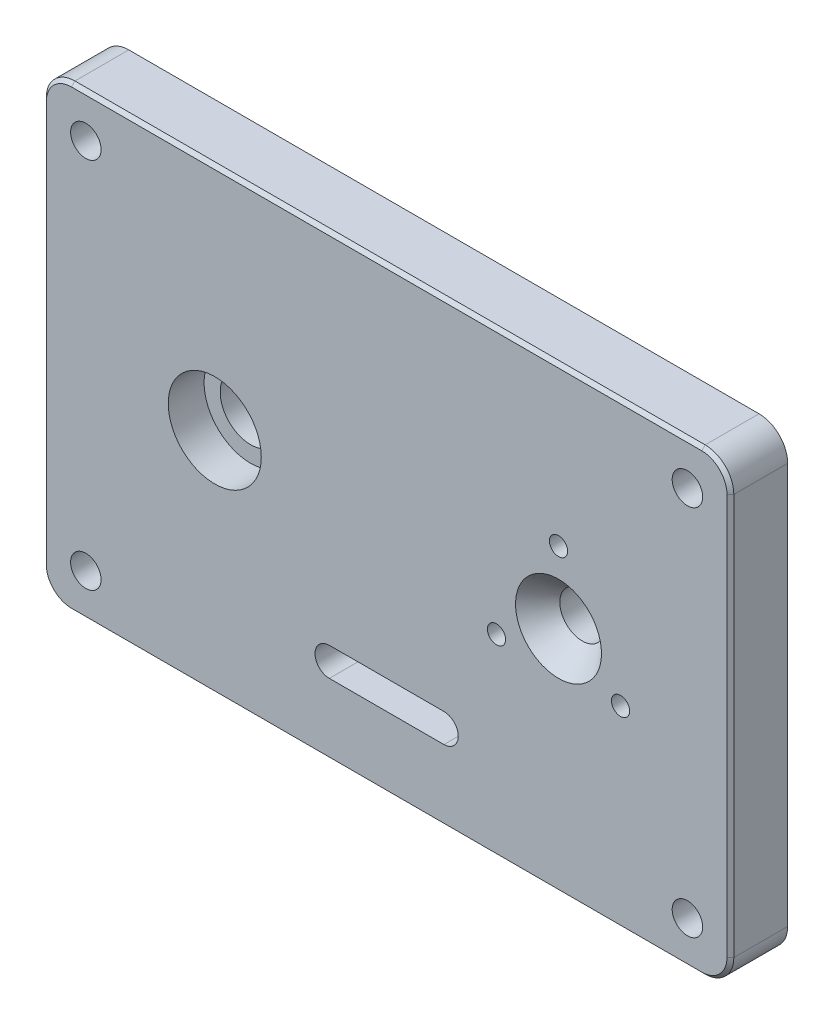
from build123d import *

# Parameters (mm, degrees)
EXTRUDE_1_DEPTH               = 12.7
SKETCH_2_R                    = 3.3782
CUT_EXTRUDE_1_DEPTH           = 184.601770144
SKETCH_5_R                    = 10.3125
CUT_EXTRUDE_4_DEPTH           = 7.95
SKETCH_6_R                    = 6.7435
CUT_EXTRUDE_5_DEPTH           = 184.601770144
SKETCH_7_R                    = 9.525
CUT_EXTRUDE_6_DEPTH           = 5.245104753
CUT_EXTRUDE_6_DRAFT           = -41
SKETCH_8_R                    = 4.9655
CUT_EXTRUDE_7_DEPTH           = 184.601770144
SKETCH_9_R                    = 2.0193
CUT_EXTRUDE_8_DEPTH           = 9.525
SKETCH_10_R                   = 2.0193
CUT_EXTRUDE_9_DEPTH           = 1.210313545
CUT_EXTRUDE_9_DRAFT           = -59
CUT_EXTRUDE_9_PROFILE_2_DEPTH = 1.210313545
CUT_EXTRUDE_9_PROFILE_2_DRAFT = -59
CUT_EXTRUDE_9_PROFILE_3_DEPTH = 1.210313545
CUT_EXTRUDE_9_PROFILE_3_DRAFT = -59
CUT_EXTRUDE_10_DEPTH          = 184.601770144
CHAMFER_1_SIZE                = 0.762


with BuildPart() as part:
    # 草图1 → 凸台-拉伸1 (new body)
    with BuildSketch(Plane.XY):
        with BuildLine():
            Line((6.35, 0), (146.05, 0))
            ThreePointArc((146.05, 0), (150.540128061, 1.859871939), (152.4, 6.35))
            Line((152.4, 6.35), (152.4, 95.25))
            ThreePointArc((152.4, 95.25), (150.540128061, 99.740128061), (146.05, 101.6))
            Line((146.05, 101.6), (6.35, 101.6))
            ThreePointArc((6.35, 101.6), (1.859871939, 99.740128061), (0, 95.25))
            Line((0, 95.25), (0, 6.35))
            ThreePointArc((0, 6.35), (1.859871939, 1.859871939), (6.35, 0))
        make_face()
    extrude(amount=EXTRUDE_1_DEPTH)

    # 草图2 → 切除-拉伸1 (cut, through all)
    with BuildSketch(Plane.XY.offset(12.7)):
        with Locations((9.525, 9.525)):
            Circle(SKETCH_2_R)
        with Locations((142.875, 9.525)):
            Circle(SKETCH_2_R)
        with Locations((9.525, 92.075)):
            Circle(SKETCH_2_R)
        with Locations((142.875, 92.075)):
            Circle(SKETCH_2_R)
    extrude(amount=-CUT_EXTRUDE_1_DEPTH, mode=Mode.SUBTRACT)

    # 草图5 → 切除-拉伸4 (cut)
    with BuildSketch(Plane.XY.offset(12.7)):
        with Locations((38.1, 50.8)):
            Circle(SKETCH_5_R)
    extrude(amount=-CUT_EXTRUDE_4_DEPTH, mode=Mode.SUBTRACT)

    # 草图6 → 切除-拉伸5 (cut, through all)
    with BuildSketch(Plane.XY.offset(12.7)):
        with Locations((38.1, 50.8)):
            Circle(SKETCH_6_R)
    extrude(amount=-CUT_EXTRUDE_5_DEPTH, mode=Mode.SUBTRACT)


with BuildPart() as cut_extrude_6_tool:
    # 草图7 → 切除-拉伸6 (with draft: the straight prism first)
    with BuildSketch(Plane.XY.offset(12.7)):
        with Locations((114.3, 50.8)):
            Circle(SKETCH_7_R)
    extrude(amount=-CUT_EXTRUDE_6_DEPTH)
    # 切除-拉伸6: the draft: its side faces are tilted about the plane it starts from
    cut_extrude_6_sides = [cut_extrude_6_tool.faces().sort_by_distance(p)[0] for p in [
        (104.775, 50.8, 10.077447624),
    ]]
    draft(cut_extrude_6_sides, Plane.XY.offset(12.7), CUT_EXTRUDE_6_DRAFT)


with BuildPart() as part_1:
    add(part.part)

    # 切除-拉伸6: cut by cut_extrude_6_tool
    add(cut_extrude_6_tool.part, mode=Mode.SUBTRACT)

    # 草图8 → 切除-拉伸7 (cut, through all)
    with BuildSketch(Plane.XY.offset(12.7)):
        with Locations((114.3, 50.8)):
            Circle(SKETCH_8_R)
    extrude(amount=-CUT_EXTRUDE_7_DEPTH, mode=Mode.SUBTRACT)

    # 草图9 → 切除-拉伸8 (cut)
    with BuildSketch(Plane.XY.offset(12.7)):
        with Locations((114.3, 66.675)):
            Circle(SKETCH_9_R)
        with Locations((100.551847, 42.8625)):
            Circle(SKETCH_9_R)
        with Locations((128.048153, 42.8625)):
            Circle(SKETCH_9_R)
    extrude(amount=-CUT_EXTRUDE_8_DEPTH, mode=Mode.SUBTRACT)


with BuildPart() as cut_extrude_9_tool:
    # 草图10 → 切除-拉伸9 (with draft: the straight prism first)
    with BuildSketch(Plane.XY.offset(3.175)):
        with Locations((114.3, 66.675)):
            Circle(SKETCH_10_R)
    extrude(amount=-CUT_EXTRUDE_9_DEPTH)
    # 切除-拉伸9: the draft: its side faces are tilted about the plane it starts from
    cut_extrude_9_sides = [cut_extrude_9_tool.faces().sort_by_distance(p)[0] for p in [
        (112.2807, 66.675, 2.569843228),
    ]]
    draft(cut_extrude_9_sides, Plane.XY.offset(3.175), CUT_EXTRUDE_9_DRAFT)


with BuildPart() as part_2:
    add(part_1.part)

    # 切除-拉伸9: cut by cut_extrude_9_tool
    add(cut_extrude_9_tool.part, mode=Mode.SUBTRACT)


with BuildPart() as cut_extrude_9_profile_2_tool:
    # 草图10 → 切除-拉伸9 profile 2 (with draft: the straight prism first)
    with BuildSketch(Plane.XY.offset(3.175)):
        with Locations((100.551847, 42.8625)):
            Circle(SKETCH_10_R)
    extrude(amount=-CUT_EXTRUDE_9_PROFILE_2_DEPTH)
    # 切除-拉伸9 profile 2: the draft: its side faces are tilted about the plane it starts from
    cut_extrude_9_profile_2_sides = [cut_extrude_9_profile_2_tool.faces().sort_by_distance(p)[0] for p in [
        (98.532547, 42.8625, 2.569843228),
    ]]
    draft(cut_extrude_9_profile_2_sides, Plane.XY.offset(3.175), CUT_EXTRUDE_9_PROFILE_2_DRAFT)


with BuildPart() as part_3:
    add(part_2.part)

    # 切除-拉伸9 profile 2: cut by cut_extrude_9_profile_2_tool
    add(cut_extrude_9_profile_2_tool.part, mode=Mode.SUBTRACT)


with BuildPart() as cut_extrude_9_profile_3_tool:
    # 草图10 → 切除-拉伸9 profile 3 (with draft: the straight prism first)
    with BuildSketch(Plane.XY.offset(3.175)):
        with Locations((128.048153, 42.8625)):
            Circle(SKETCH_10_R)
    extrude(amount=-CUT_EXTRUDE_9_PROFILE_3_DEPTH)
    # 切除-拉伸9 profile 3: the draft: its side faces are tilted about the plane it starts from
    cut_extrude_9_profile_3_sides = [cut_extrude_9_profile_3_tool.faces().sort_by_distance(p)[0] for p in [
        (126.028853, 42.8625, 2.569843228),
    ]]
    draft(cut_extrude_9_profile_3_sides, Plane.XY.offset(3.175), CUT_EXTRUDE_9_PROFILE_3_DRAFT)


with BuildPart() as part_4:
    add(part_3.part)

    # 切除-拉伸9 profile 3: cut by cut_extrude_9_profile_3_tool
    add(cut_extrude_9_profile_3_tool.part, mode=Mode.SUBTRACT)

    # 草图11 → 切除-拉伸10 (cut, through all)
    with BuildSketch(Plane.XY.offset(12.7)):
        with BuildLine():
            Line((63.5, 15.875), (88.9, 15.875))
            ThreePointArc((88.9, 15.875), (92.075, 19.05), (88.9, 22.225))
            Line((88.9, 22.225), (63.5, 22.225))
            ThreePointArc((63.5, 22.225), (60.325, 19.05), (63.5, 15.875))
        make_face()
    extrude(amount=-CUT_EXTRUDE_10_DEPTH, mode=Mode.SUBTRACT)

    # 倒角1
    chamfer_1_edges = [part_4.edges().sort_by_distance(p)[0] for p in [
        (150.540128061, 1.859871939, 12.7),
        (152.4, 50.8, 12.7),
        (150.540128061, 99.740128061, 12.7),
        (76.2, 101.6, 12.7),
        (1.859871939, 99.740128061, 12.7),
        (0, 50.8, 12.7),
        (1.859871939, 1.859871939, 12.7),
        (76.2, 0, 12.7),
    ]]
    chamfer(chamfer_1_edges, length=CHAMFER_1_SIZE)


solid = part_4.part
